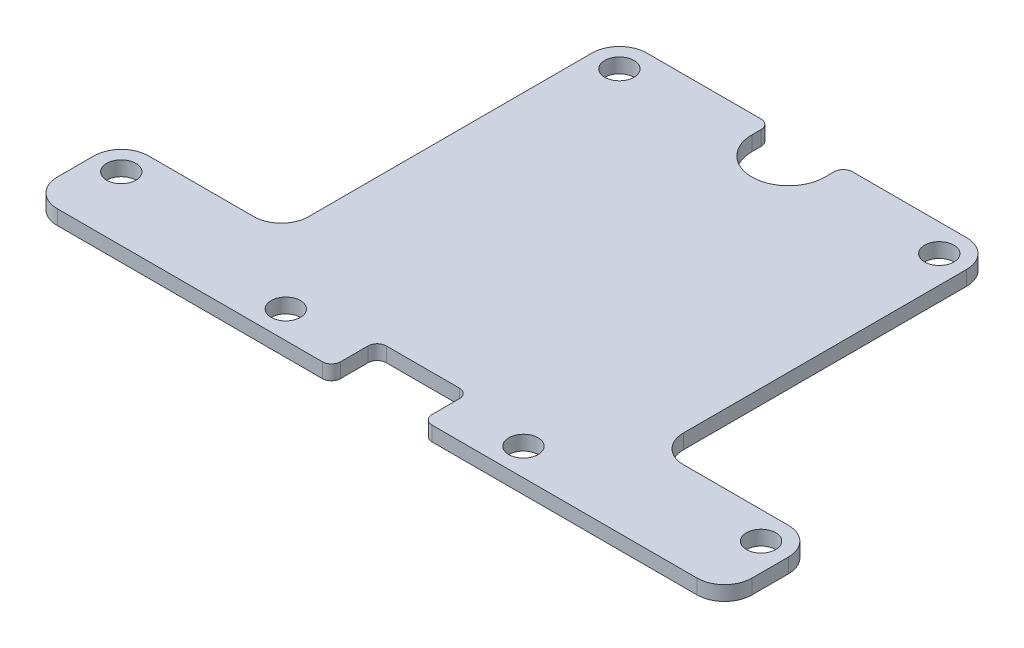
from build123d import *

# Parameters (mm, degrees)
EXTRUDE_1_DEPTH     = 1.6
CUT_EXTRUDE_1_DEPTH = 10
SKETCH_3_R          = 1.6
CUT_EXTRUDE_2_DEPTH = 94.525061209
CUT_EXTRUDE_3_DEPTH = 5


with BuildPart() as part:
    # 草图1 → 凸台-拉伸1 (new body)
    with BuildSketch(Plane(origin=(0, 0, 0), x_dir=(1, 0, 0), z_dir=(0, 1, 0))):
        with BuildLine():
            Line((7.841679065, 0), (77.841679065, 0))
            ThreePointArc((77.841679065, 0), (79.962999409, 0.878679656), (80.841679065, 3))
            Line((80.841679065, 3), (80.841679065, 7))
            ThreePointArc((80.841679065, 7), (79.962999409, 9.121320344), (77.841679065, 10))
            Line((77.841679065, 10), (66.341679065, 10))
            ThreePointArc((66.341679065, 10), (64.220358721, 10.878679656), (63.341679065, 13))
            Line((63.341679065, 13), (63.341679065, 44))
            ThreePointArc((63.341679065, 44), (62.462999409, 46.121320344), (60.341679065, 47))
            Line((60.341679065, 47), (25.341679065, 47))
            ThreePointArc((25.341679065, 47), (23.220358721, 46.121320344), (22.341679065, 44))
            Line((22.341679065, 44), (22.341679065, 13))
            ThreePointArc((22.341679065, 13), (21.462999409, 10.878679656), (19.341679065, 10))
            Line((19.341679065, 10), (7.841679065, 10))
            ThreePointArc((7.841679065, 10), (5.720358721, 9.121320344), (4.841679065, 7))
            Line((4.841679065, 7), (4.841679065, 3))
            ThreePointArc((4.841679065, 3), (5.720358721, 0.878679656), (7.841679065, 0))
        make_face()
    extrude(amount=EXTRUDE_1_DEPTH)

    # 草图2 → 切除-拉伸1 (cut)
    with BuildSketch(Plane(origin=(0, 1.6, 0), x_dir=(1, 0, 0), z_dir=(0, 1, 0))):
        with BuildLine():
            Line((37.841679065, 1), (37.841679065, 4))
            ThreePointArc((37.841679065, 4), (38.134572284, 4.707106781), (38.841679065, 5))
            Line((38.841679065, 5), (46.841679065, 5))
            ThreePointArc((46.841679065, 5), (47.548785846, 4.707106781), (47.841679065, 4))
            Line((47.841679065, 4), (47.841679065, 1))
            ThreePointArc((47.841679065, 1), (48.134572284, 0.292893219), (48.841679065, 0))
            Line((48.841679065, 0), (36.841679065, 0))
            ThreePointArc((36.841679065, 0), (37.548785846, 0.292893219), (37.841679065, 1))
        make_face()
    extrude(amount=-CUT_EXTRUDE_1_DEPTH, mode=Mode.SUBTRACT)

    # 草图3 → 切除-拉伸2 (cut, through all)
    with BuildSketch(Plane(origin=(0, 1.6, 0), x_dir=(1, 0, 0), z_dir=(0, 1, 0))):
        with Locations(Location((7.841679065, 7, 0), (0, 0, 270))):
            Circle(SKETCH_3_R)
        with Locations(Location((29.841679065, 3, 0), (0, 0, 270))):
            Circle(SKETCH_3_R)
        with Locations(Location((25.341679065, 44, 0), (0, 0, 270))):
            Circle(SKETCH_3_R)
        with Locations(Location((60.341679065, 44, 0), (0, 0, 90))):
            Circle(SKETCH_3_R)
        with Locations(Location((55.841679065, 3, 0), (0, 0, 90))):
            Circle(SKETCH_3_R)
        with Locations(Location((77.841679065, 7, 0), (0, 0, 90))):
            Circle(SKETCH_3_R)
    extrude(amount=-CUT_EXTRUDE_2_DEPTH, mode=Mode.SUBTRACT)

    # 草图4 → 切除-拉伸3 (cut)
    with BuildSketch(Plane(origin=(0, 1.6, 0), x_dir=(1, 0, 0), z_dir=(0, 1, 0))):
        with BuildLine():
            Line((46.841679065, 45), (46.841679065, 46))
            ThreePointArc((46.841679065, 46), (47.134572284, 46.707106781), (47.841679065, 47))
            Line((47.841679065, 47), (37.841679065, 47))
            ThreePointArc((37.841679065, 47), (38.548785846, 46.707106781), (38.841679065, 46))
            Line((38.841679065, 46), (38.841679065, 45))
            ThreePointArc((38.841679065, 45), (42.841679065, 41), (46.841679065, 45))
        make_face()
    extrude(amount=-CUT_EXTRUDE_3_DEPTH, mode=Mode.SUBTRACT)


solid = part.part
